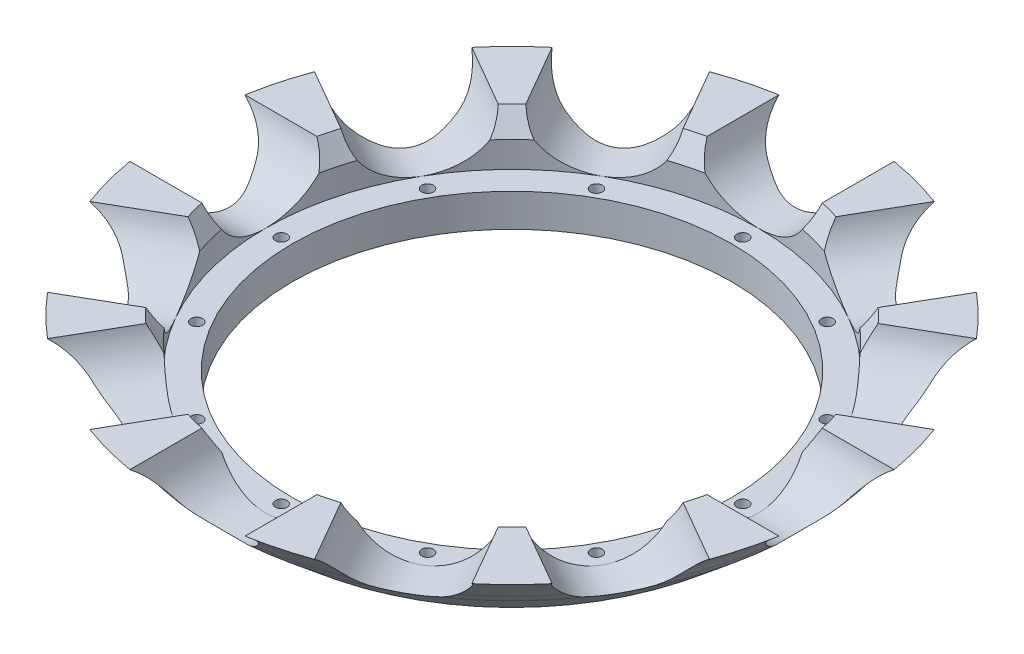
from build123d import *

# Parameters (mm, degrees)
SKETCH1_W          = 6.5
SKETCH1_H          = 9
SKETCH2_R          = 1.6
CUT_EXTRUDE1_DEPTH = 95.474864382
CIRPATTERN1_COUNT  = 12
SKETCH4_R          = 16
CUT_EXTRUDE2_DEPTH = 132.240237732
CIRPATTERN2_COUNT  = 12


with BuildPart() as part:
    # Sketch1 → Revolve1 (revolve)
    with BuildSketch(Plane.XY, mode=Mode.PRIVATE) as revolve1_sk:
        with Locations((-63.25, 14.465)):
            Rectangle(SKETCH1_W, SKETCH1_H)
    revolve(revolve1_sk.sketch.rotate(Axis((0, -200069.047495165, 0), (0, 1, 0)), 270), axis=Axis((0, -200069.047495165, 0), (0, 1, 0)))

    # Sketch2 → Cut-Extrude1 (cut, through all)
    with BuildSketch(Plane(origin=(0, 18.965, 0), x_dir=(1, 0, 0), z_dir=(0, 1, 0))):
        with Locations(Location((0, 63, 0), (0, 0, 270))):
            Circle(SKETCH2_R)
    cut_extrude1 = extrude(amount=-CUT_EXTRUDE1_DEPTH, mode=Mode.SUBTRACT)

    # CirPattern1: Cut-Extrude1 ×12 about axis
    cirpattern1_axis = Axis((0, 0, 0), (0, 1, 0))
    for i in range(1, CIRPATTERN1_COUNT):
        add(cut_extrude1.rotate(cirpattern1_axis, i * 360 / CIRPATTERN1_COUNT), mode=Mode.SUBTRACT)

    # Sketch3 → Revolve2 (revolve)
    with BuildSketch(Plane.XY, mode=Mode.PRIVATE) as revolve2_sk:
        with BuildLine():
            Line((-66.5, 18.965), (-66.5, 9.965))
            Line((-66.5, 9.965), (-78.5, 20.034195574))
            ThreePointArc((-78.5, 20.034195574), (-79.987399004, 21.45961793), (-81.274272951, 23.068387688))
            ThreePointArc((-81.274272951, 23.068387688), (-85.267770471, 27.895045483), (-90, 32))
            Line((-90, 32), (-84.07974624, 32))
            Line((-84.07974624, 32), (-70.744358791, 32))
            Line((-70.744358791, 32), (-67.3, 26.034195574))
            Line((-67.3, 26.034195574), (-67.3, 20.034195574))
            Line((-67.3, 20.034195574), (-67.3, 18.965))
            Line((-67.3, 18.965), (-66.5, 18.965))
        make_face()
    revolve(revolve2_sk.sketch.rotate(Axis((0, 0, 0), (0, 1, 0)), 270), axis=Axis((0, 0, 0), (0, 1, 0)))

    # Sketch4 → Cut-Extrude2 (cut, through all)
    with BuildSketch(Plane.XY):
        with Locations((0, 34.965)):
            Circle(SKETCH4_R)
    cut_extrude2 = extrude(amount=CUT_EXTRUDE2_DEPTH, mode=Mode.SUBTRACT)

    # CirPattern2: Cut-Extrude2 ×12 about axis
    cirpattern2_axis = Axis((0, 9.965, 0), (0, -1, 0))
    for i in range(1, CIRPATTERN2_COUNT):
        add(cut_extrude2.rotate(cirpattern2_axis, i * 360 / CIRPATTERN2_COUNT), mode=Mode.SUBTRACT)


solid = part.part
